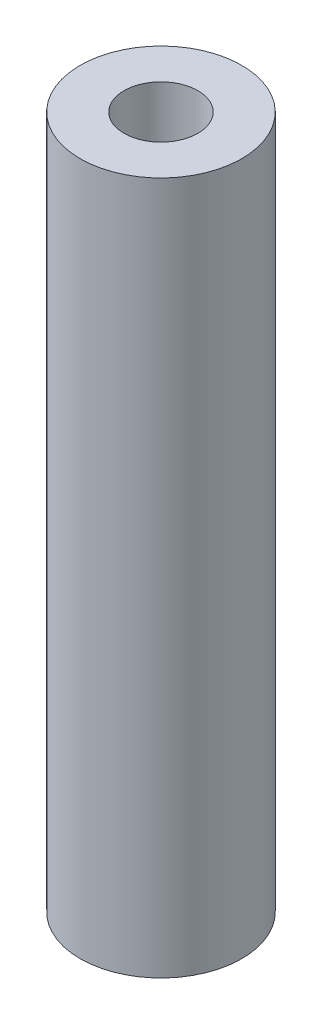
from build123d import *

# Parameters (mm, degrees)
SKETCH1_R           = 3.5
SKETCH1_R_2         = 1.6
BOSS_EXTRUDE1_DEPTH = 30


with BuildPart() as part:
    # Sketch1 → Boss-Extrude1 (new body)
    with BuildSketch(Plane(origin=(0, 0, 0), x_dir=(1, 0, 0), z_dir=(0, 1, 0))):
        with Locations(Location((0, 0, 0), (0, 0, 270))):
            Circle(SKETCH1_R)
        with Locations(Location((0, 0, 0), (0, 0, 270))):
            Circle(SKETCH1_R_2, mode=Mode.SUBTRACT)
    extrude(amount=BOSS_EXTRUDE1_DEPTH)


solid = part.part
